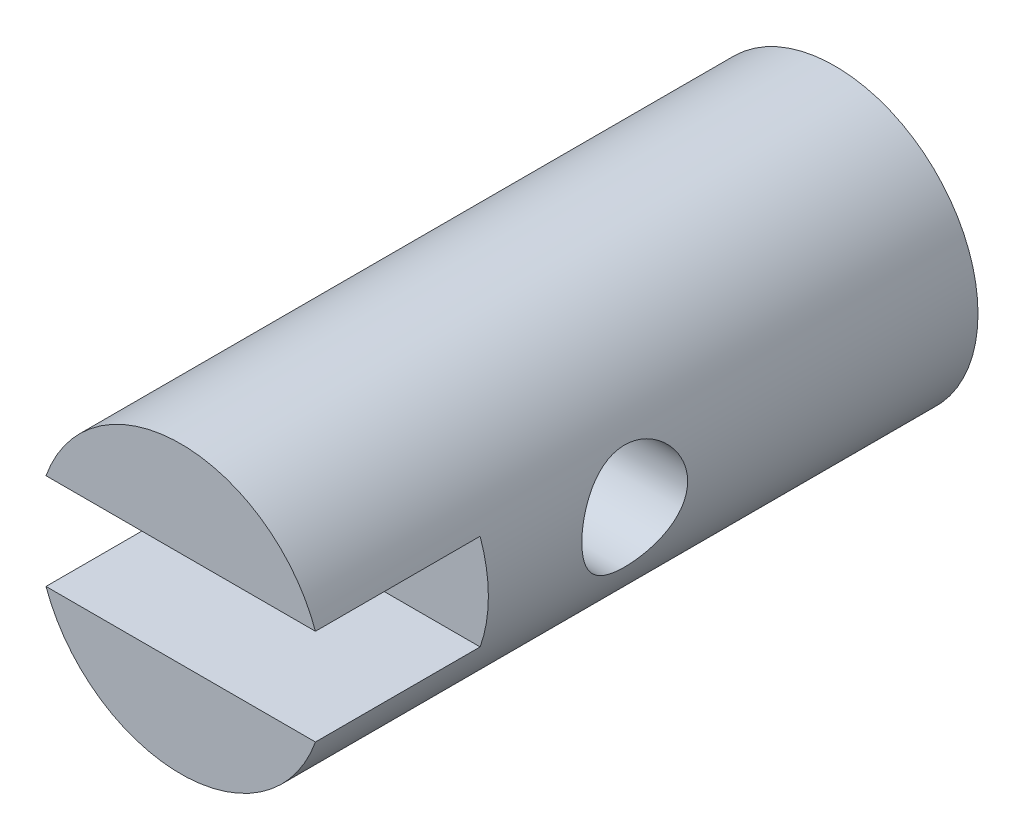
from build123d import *

# Parameters (mm, degrees)
SKETCH1_R               = 9.1313
BOSS_EXTRUDE1_DEPTH     = 41.783
CUT_EXTRUDE1_DEPTH      = 44.733058073
CUT_EXTRUDE1_DEPTH_BACK = 44.733058073
SKETCH2_R               = 3.3782
CUT_EXTRUDE3_DEPTH      = 44.73305821
CUT_EXTRUDE3_DEPTH_BACK = 44.73305821
SKETCH3_W               = 10.5156
SKETCH3_H               = 6.1214


with BuildPart() as part:
    # Sketch1 → Boss-Extrude1 (new body)
    with BuildSketch(Plane.XY):
        Circle(SKETCH1_R)
    extrude(amount=BOSS_EXTRUDE1_DEPTH)

    # Sketch2 → Cut-Extrude1 (cut, two sides: drawn at the far end of the back side and taken through both)
    with BuildSketch(Plane(origin=(0, 0, 0), x_dir=(0, 0, -1), z_dir=(1, 0, 0)).offset(-CUT_EXTRUDE1_DEPTH_BACK)):
        with Locations((-21.9202, 0)):
            Circle(SKETCH2_R)
    extrude(amount=CUT_EXTRUDE1_DEPTH + CUT_EXTRUDE1_DEPTH_BACK, mode=Mode.SUBTRACT)

    # Sketch3 → Cut-Extrude3 (cut, two sides: drawn at the far end of the back side and taken through both)
    with BuildSketch(Plane(origin=(0, 0, 0), x_dir=(0, 0, -1), z_dir=(1, 0, 0)).offset(-CUT_EXTRUDE3_DEPTH_BACK)):
        with Locations((-36.5252, 0)):
            Rectangle(SKETCH3_W, SKETCH3_H)
    extrude(amount=CUT_EXTRUDE3_DEPTH + CUT_EXTRUDE3_DEPTH_BACK, mode=Mode.SUBTRACT)


solid = part.part
